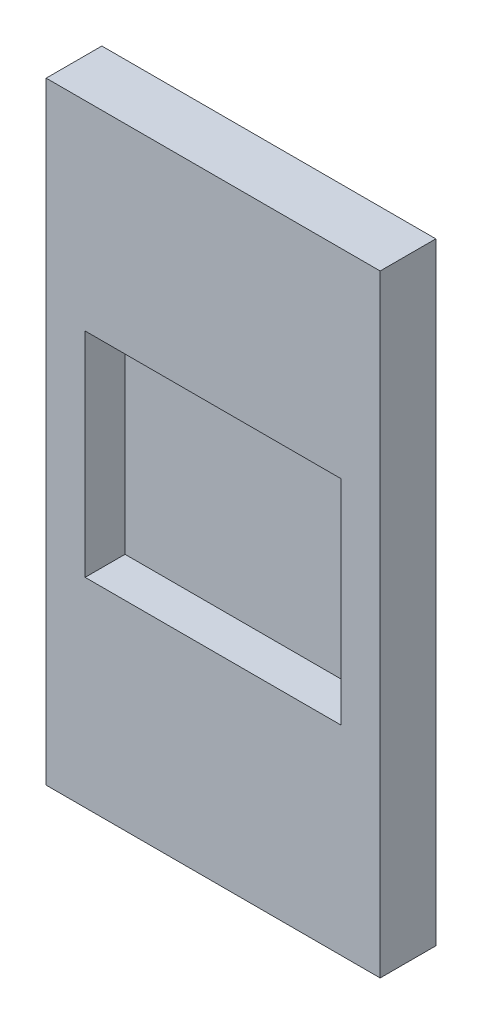
from build123d import *

# Parameters (mm, degrees)
SKETCH_1_W          = 18
SKETCH_1_H          = 33
EXTRUDE_1_DEPTH     = 3
SKETCH_2_W          = 13.8
SKETCH_2_H          = 11.5
CUT_EXTRUDE_1_DEPTH = 2.15


with BuildPart() as part:
    # 스케치1 → 보스-돌출1 (new body)
    with BuildSketch(Plane.XY):
        Rectangle(SKETCH_1_W, SKETCH_1_H)
    extrude(amount=EXTRUDE_1_DEPTH)

    # 스케치2 → 컷-돌출1 (cut)
    with BuildSketch(Plane.XY.offset(3)):
        Rectangle(SKETCH_2_W, SKETCH_2_H)
    extrude(amount=-CUT_EXTRUDE_1_DEPTH, mode=Mode.SUBTRACT)


solid = part.part
